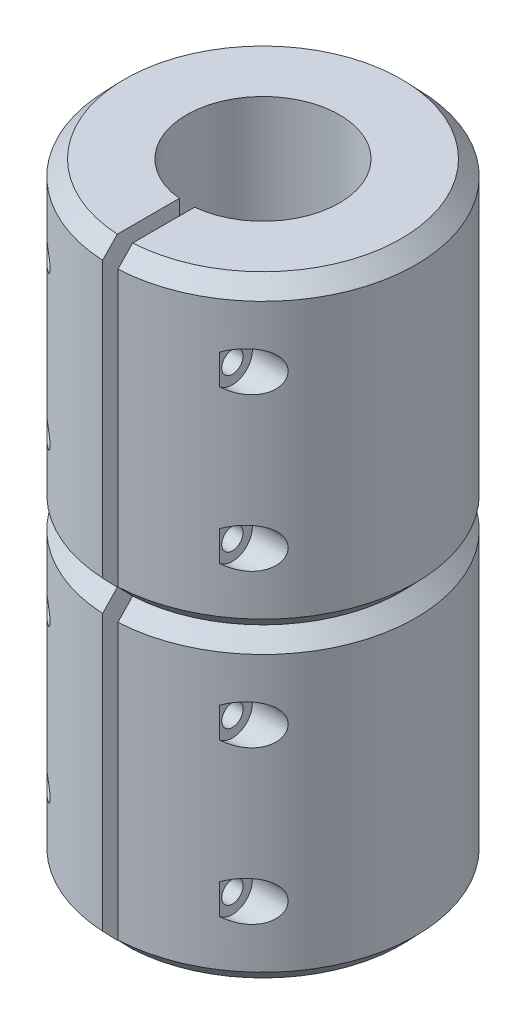
from build123d import *

# Parameters (mm, degrees)
CUT_EXTRUDE2_DEPTH      = 20
CUT_EXTRUDE3_START      = -20
SKETCH8_R               = 5
CUT_EXTRUDE3_DEPTH      = 20
CUT_EXTRUDE4_DEPTH      = 43.426406871
CUT_EXTRUDE4_DEPTH_BACK = 43.426406871
SKETCH11_R              = 0.7
CUT_EXTRUDE5_DEPTH      = 30.669007398
SKETCH13_R              = 1.3
CUT_EXTRUDE6_DEPTH      = 4


with BuildPart() as part:
    # Sketch5 → Revolve2 (revolve)
    with BuildSketch(Plane.XY, mode=Mode.PRIVATE) as revolve2_sk:
        Polygon((-9.041219405, 20), (0, 20), (0, -20), (-9.041219405, -20), (-10, -19), (-10, -1), (-9.041219405, 0), (-10, 1), (-10, 19), align=None)
    revolve(revolve2_sk.sketch.rotate(Axis((0, -53.191489362, 0), (0, 1, 0)), 180), axis=Axis((0, -53.191489362, 0), (0, 1, 0)))

    # Sketch6 → Cut-Extrude2 (cut)
    with BuildSketch(Plane(origin=(0, -20, 0), x_dir=(-1, 0, 0), z_dir=(0, -1, 0))):
        with BuildLine():
            Line((-3, 4), (-3, -4))
            ThreePointArc((-3, -4), (0, -5), (3, -4))
            Line((3, -4), (3, 4))
            ThreePointArc((3, 4), (0, 5), (-3, 4))
        make_face()
    extrude(amount=-CUT_EXTRUDE2_DEPTH, mode=Mode.SUBTRACT)

    # Sketch8 → Cut-Extrude3 (cut)
    with BuildSketch(Plane(origin=(0, 20, 0), x_dir=(1, 0, 0), z_dir=(0, 1, 0)).offset(CUT_EXTRUDE3_START)):
        with Locations(Location((0, 0, 0), (0, 0, 306.869897646))):
            Circle(SKETCH8_R)
    extrude(amount=CUT_EXTRUDE3_DEPTH, mode=Mode.SUBTRACT)

    # Sketch9 → Cut-Extrude4 (cut, two sides: drawn at the far end of the back side and taken through both)
    with BuildSketch(Plane(origin=(0, 20, 0), x_dir=(1, 0, 0), z_dir=(0, 1, 0)).offset(-CUT_EXTRUDE4_DEPTH_BACK)):
        with BuildLine():
            Line((-0.5, -4.974937186), (-0.5, -10.403800493))
            ThreePointArc((-0.5, -10.403800493), (0, -10.415808404), (0.5, -10.403800493))
            Line((0.5, -10.403800493), (0.5, -4.974937186))
            ThreePointArc((0.5, -4.974937186), (0, -5), (-0.5, -4.974937186))
        make_face()
    extrude(amount=CUT_EXTRUDE4_DEPTH + CUT_EXTRUDE4_DEPTH_BACK, mode=Mode.SUBTRACT)

    # Sketch11 → Cut-Extrude5 (cut, through all)
    with BuildSketch(Plane(origin=(9.5, 0, 0), x_dir=(0, 0, -1), z_dir=(1, 0, 0))):
        with Locations(Location((-7.5, 15, 0), (0, 0, 90))):
            Circle(SKETCH11_R)
        with Locations(Location((-7.5, 5, 0), (0, 0, 90))):
            Circle(SKETCH11_R)
        with Locations(Location((-7.5, -5, 0), (0, 0, 90))):
            Circle(SKETCH11_R)
        with Locations(Location((-7.5, -15, 0), (0, 0, 90))):
            Circle(SKETCH11_R)
    extrude(amount=-CUT_EXTRUDE5_DEPTH, mode=Mode.SUBTRACT)

    # Sketch13 → Cut-Extrude6 (cut)
    with BuildSketch(Plane(origin=(9.5, 0, 0), x_dir=(0, 0, -1), z_dir=(1, 0, 0))):
        with Locations((-7.5, 15)):
            Circle(SKETCH13_R)
        with Locations((-7.5, 5)):
            Circle(SKETCH13_R)
        with Locations((-7.5, -5)):
            Circle(SKETCH13_R)
        with Locations((-7.5, -15)):
            Circle(SKETCH13_R)
    extrude(amount=-CUT_EXTRUDE6_DEPTH, mode=Mode.SUBTRACT)


solid = part.part
